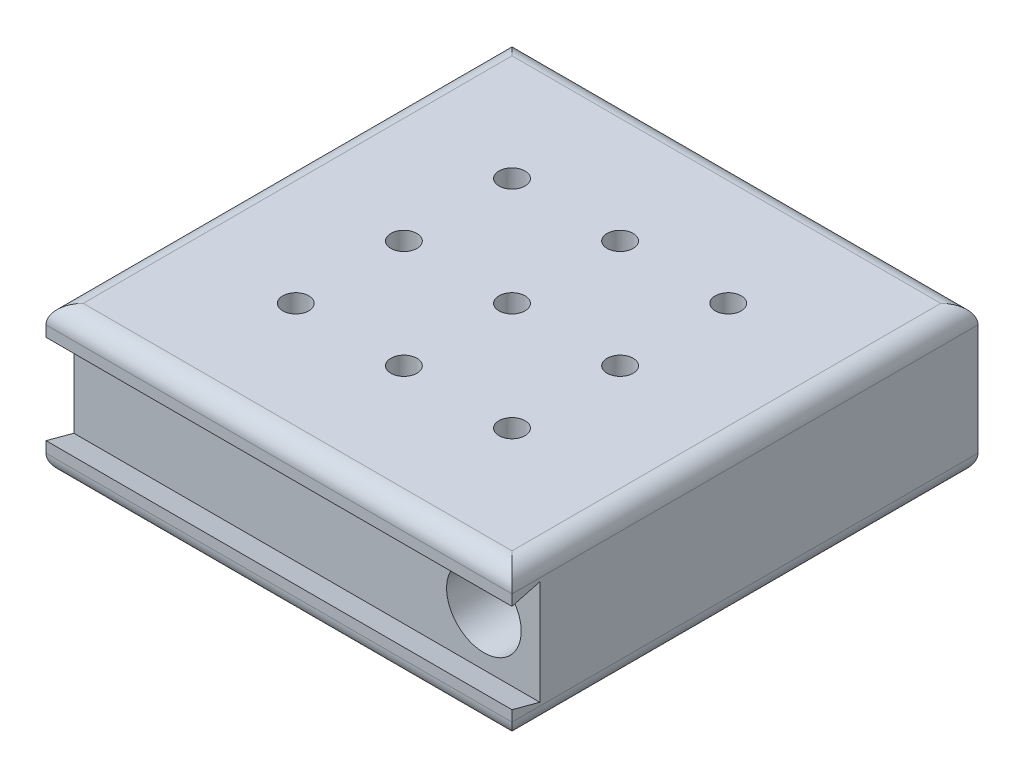
from build123d import *

# Parameters (mm, degrees)
SKETCH1_W           = 125
SKETCH1_H           = 125
BOSS_EXTRUDE1_DEPTH = 39.8
CUT_EXTRUDE1_DEPTH  = 132.8
SKETCH3_R           = 10
CUT_EXTRUDE2_DEPTH  = 40
FILLET1_R           = 5
FILLET2_R           = 5
SKETCH4_R           = 3.5
CUT_EXTRUDE3_DEPTH  = 22


with BuildPart() as part:
    # Sketch1 → Boss-Extrude1 (new body)
    with BuildSketch(Plane(origin=(0, 0, 0), x_dir=(1, 0, 0), z_dir=(0, 1, 0))):
        with Locations((62.5, 62.5)):
            Rectangle(SKETCH1_W, SKETCH1_H)
    extrude(amount=BOSS_EXTRUDE1_DEPTH)

    # Sketch2 → Cut-Extrude1 (cut)
    with BuildSketch(Plane(origin=(125, 0, 0), x_dir=(0, 0, -1), z_dir=(1, 0, 0))):
        Polygon((0, 31.9), (7.464101615, 33.9), (7.464101615, 5.9), (0, 7.9), align=None)
    extrude(amount=-CUT_EXTRUDE1_DEPTH, mode=Mode.SUBTRACT)

    # Sketch3 → Cut-Extrude2 (cut)
    with BuildSketch(Plane.XY.offset(-7.464101615)):
        with Locations((110, 19.9)):
            Circle(SKETCH3_R)
    extrude(amount=-CUT_EXTRUDE2_DEPTH, mode=Mode.SUBTRACT)

    # Fillet1
    fillet1_edges = [part.edges().sort_by_distance(p)[0] for p in [
        (125, 39.8, -62.5),
        (62.5, 39.8, -125),
        (0, 39.8, -62.5),
        (62.5, 39.8, 0),
    ]]
    fillet(fillet1_edges, radius=FILLET1_R)

    # Fillet2
    fillet2_edges = [part.edges().sort_by_distance(p)[0] for p in [
        (62.5, 0, -125),
        (125, 0, -62.5),
        (62.5, 0, 0),
        (0, 0, -62.5),
    ]]
    fillet(fillet2_edges, radius=FILLET2_R)

    # Sketch4 → Cut-Extrude3 (cut)
    with BuildSketch(Plane(origin=(0, 39.8, 0), x_dir=(1, 0, 0), z_dir=(0, 1, 0))):
        with Locations(Location((33.5, 91.5, 0), (0, 0, 270))):
            Circle(SKETCH4_R)
        with Locations(Location((62.5, 91.5, 0), (0, 0, 270))):
            Circle(SKETCH4_R)
        with Locations(Location((91.5, 91.5, 0), (0, 0, 270))):
            Circle(SKETCH4_R)
        with Locations(Location((33.5, 62.5, 0), (0, 0, 270))):
            Circle(SKETCH4_R)
        with Locations(Location((62.5, 62.5, 0), (0, 0, 270))):
            Circle(SKETCH4_R)
        with Locations(Location((91.5, 62.5, 0), (0, 0, 270))):
            Circle(SKETCH4_R)
        with Locations(Location((33.5, 33.5, 0), (0, 0, 270))):
            Circle(SKETCH4_R)
        with Locations(Location((62.5, 33.5, 0), (0, 0, 270))):
            Circle(SKETCH4_R)
        with Locations(Location((91.5, 33.5, 0), (0, 0, 270))):
            Circle(SKETCH4_R)
    extrude(amount=-CUT_EXTRUDE3_DEPTH, mode=Mode.SUBTRACT)


solid = part.part
